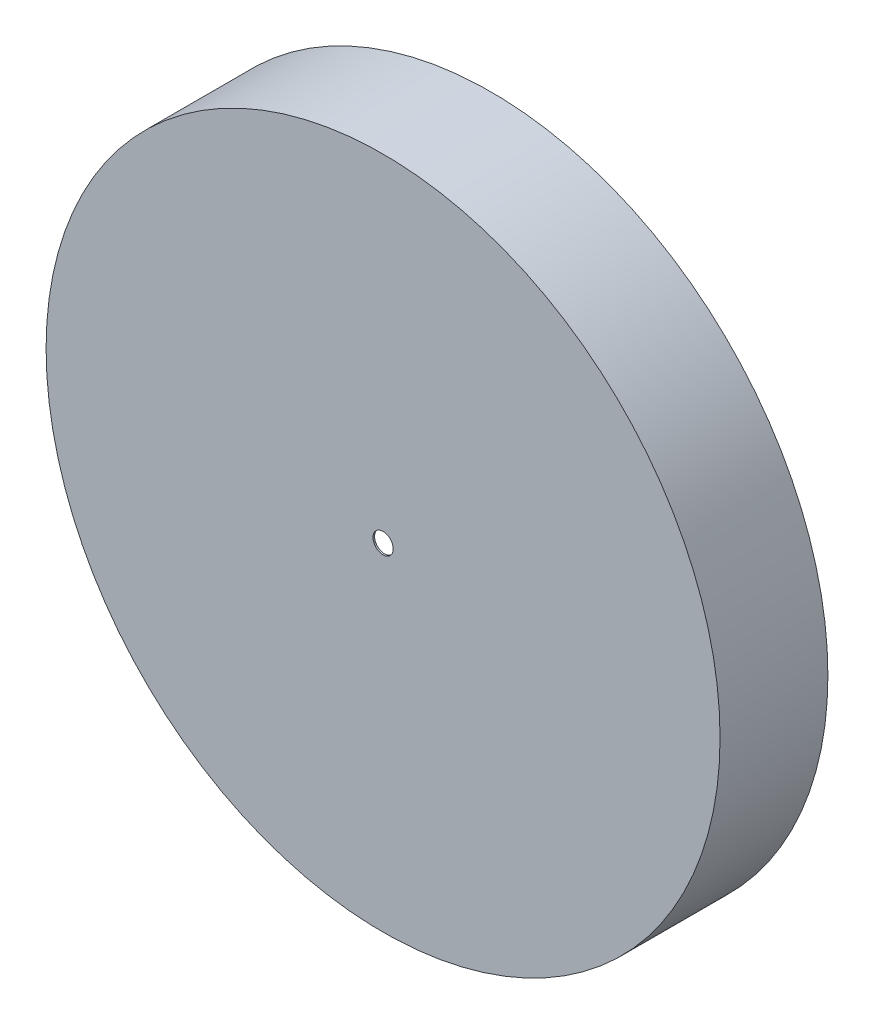
from build123d import *

# Parameters (mm, degrees)
SKETCH1_R           = 250
BOSS_EXTRUDE1_DEPTH = 80
SHELL1_T            = -1.2
SKETCH2_R           = 7.5
CUT_EXTRUDE1_DEPTH  = 10


with BuildPart() as part:
    # Sketch1 → Boss-Extrude1 (new body)
    with BuildSketch(Plane.XY):
        Circle(SKETCH1_R)
    extrude(amount=BOSS_EXTRUDE1_DEPTH)

    # Shell1
    shell1_openings = [part.faces().sort_by_distance(p)[0] for p in [
        (0, 0, 0),
    ]]
    offset(amount=SHELL1_T, openings=shell1_openings, kind=Kind.INTERSECTION)

    # Sketch2 → Cut-Extrude1 (cut)
    with BuildSketch(Plane(origin=(0, 0, 78.8), x_dir=(-1, 0, 0), z_dir=(0, 0, -1))):
        Circle(SKETCH2_R)
    extrude(amount=-CUT_EXTRUDE1_DEPTH, mode=Mode.SUBTRACT)


solid = part.part
